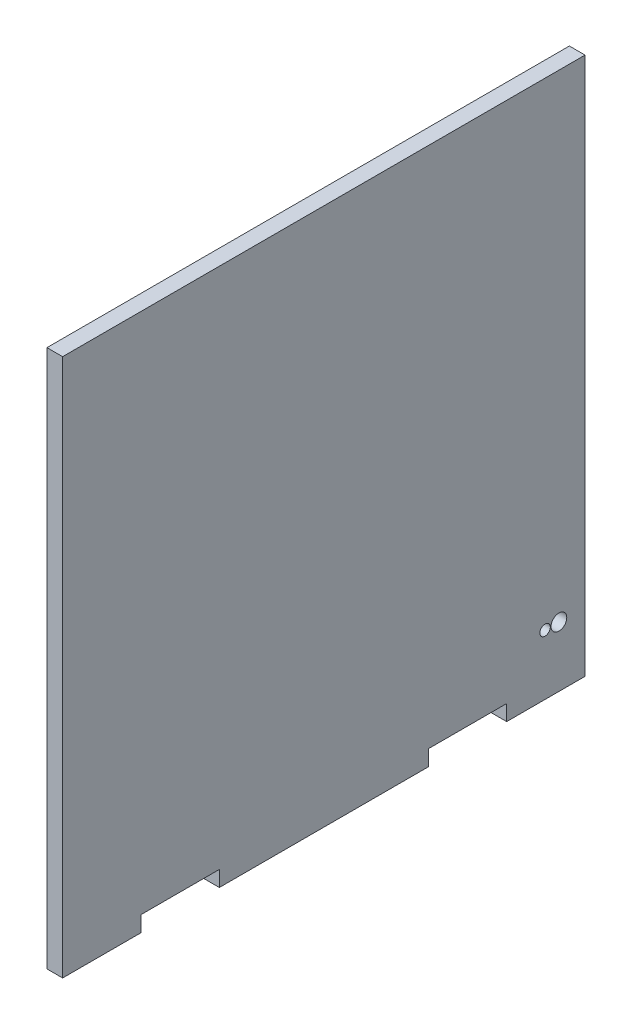
from build123d import *

# Parameters (mm, degrees)
RESSALTO_EXTRUS_O3_DEPTH = 6
ESBO_O3_R                = 3
ESBO_O3_R_2              = 2
CORTE_EXTRUS_O4_DEPTH    = 6


with BuildPart() as part:
    # Esboço1 → Ressalto-extrusão3 (new body)
    with BuildSketch(Plane(origin=(0, 0, 0), x_dir=(0, 0, -1), z_dir=(1, 0, 0))):
        Polygon((-70, -103), (-100, -103), (-100, 103), (100, 103), (100, -103), (70, -103), (70, -97), (40, -97), (40, -103), (-40, -103), (-40, -97), (-70, -97), align=None)
    extrude(amount=RESSALTO_EXTRUS_O3_DEPTH)

    # Esboço3 → Corte-extrusão4 (cut)
    with BuildSketch(Plane(origin=(6, 0, 0), x_dir=(0, 0, -1), z_dir=(1, 0, 0))):
        with Locations((90, -80)):
            Circle(ESBO_O3_R)
        with Locations((84.7, -80)):
            Circle(ESBO_O3_R_2)
    extrude(amount=-CORTE_EXTRUS_O4_DEPTH, mode=Mode.SUBTRACT)


solid = part.part
